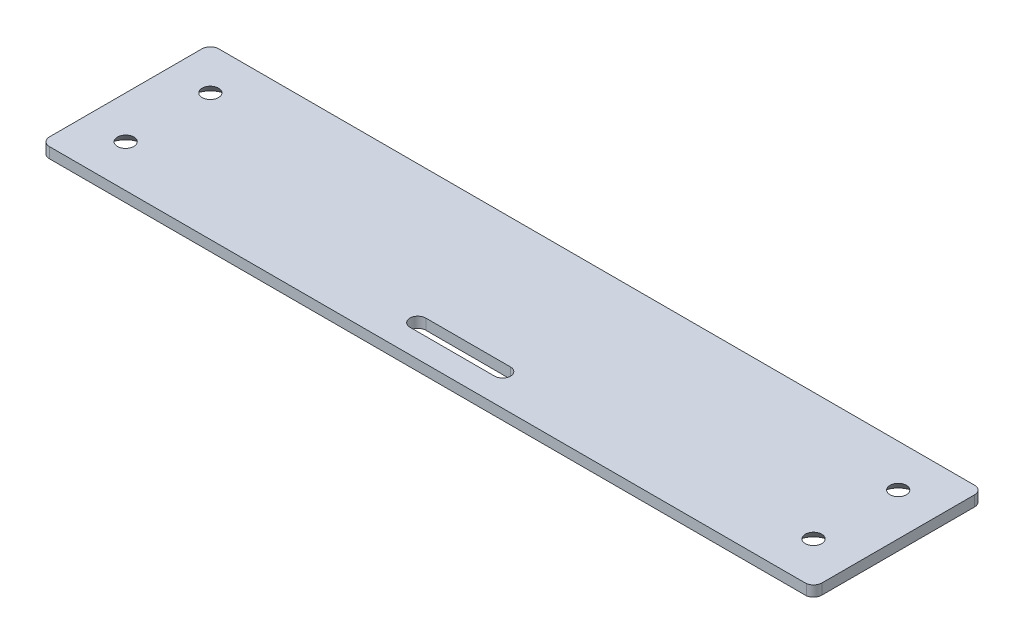
from build123d import *

# Parameters (mm, degrees)
BOSS_EXTRUDE1_DEPTH                   = 3.175
F_10_0_1935_DIAMETER_HOLE1_AT_2_COUNT = 2
F_10_0_1935_DIAMETER_HOLE1_AT_2_PITCH = 25.4
F_10_0_1935_DIAMETER_HOLE1_AT_3_COUNT = 2
F_10_0_1935_DIAMETER_HOLE1_AT_3_PITCH = 207.932201991
F_10_0_1935_DIAMETER_HOLE1_AT_4_COUNT = 2
F_10_0_1935_DIAMETER_HOLE1_AT_4_PITCH = 206.375
CUT_EXTRUDE1_DEPTH                    = 3.175


with BuildPart() as part:
    # Sketch1 → Boss-Extrude1 (new body)
    with BuildSketch(Plane(origin=(0, 0, 0), x_dir=(1, 0, 0), z_dir=(0, 1, 0))):
        with BuildLine():
            Line((22.125366444, -125.50484625), (-204.925528738, -125.50484625))
            ThreePointArc((-204.925528738, -125.50484625), (-206.721579962, -126.248795026), (-207.465528738, -128.04484625))
            Line((-207.465528738, -128.04484625), (-207.465528738, -173.76484625))
            ThreePointArc((-207.465528738, -173.76484625), (-206.721579962, -175.560897474), (-204.925528738, -176.30484625))
            Line((-204.925528738, -176.30484625), (22.125366444, -176.30484625))
            ThreePointArc((22.125366444, -176.30484625), (23.687226951, -175.455380029), (24.309471262, -173.789903185))
            Line((24.309471262, -173.789903185), (24.309471262, -128.019789315))
            ThreePointArc((24.309471262, -128.019789315), (23.687226951, -126.354312471), (22.125366444, -125.50484625))
        make_face()
    extrude(amount=BOSS_EXTRUDE1_DEPTH)

    # Sketch4 → #10 (0.1935) Diameter Hole1 (revolve, cut)
    with BuildSketch(Plane(origin=(11.609471262, 0, 163.60484625), x_dir=(0, 0, -1), z_dir=(1, 0, 0))):
        Polygon((0, 0), (0, 3.175), (2.45745, 3.175), (2.45745, 3.177605133), (5.2197, 0), align=None)
    f_10_0_1935_diameter_hole1 = revolve(axis=Axis((11.609471262, -6.35, 163.60484625), (0, 1, 0)), mode=Mode.SUBTRACT)

    # #10 (0.1935) Diameter Hole1 at 2: #10 (0.1935) Diameter Hole1 ×2
    with Locations(*[(0, 0, -i * F_10_0_1935_DIAMETER_HOLE1_AT_2_PITCH) for i in range(1, F_10_0_1935_DIAMETER_HOLE1_AT_2_COUNT)]):
        add(f_10_0_1935_diameter_hole1, mode=Mode.SUBTRACT)

    # #10 (0.1935) Diameter Hole1 at 3: #10 (0.1935) Diameter Hole1 ×2
    with Locations(*[Vector(-0.9925110109136314, 0, -0.12215520134321609) * (i * F_10_0_1935_DIAMETER_HOLE1_AT_3_PITCH) for i in range(1, F_10_0_1935_DIAMETER_HOLE1_AT_3_COUNT)]):
        add(f_10_0_1935_diameter_hole1, mode=Mode.SUBTRACT)

    # #10 (0.1935) Diameter Hole1 at 4: #10 (0.1935) Diameter Hole1 ×2
    with Locations(*[(-i * F_10_0_1935_DIAMETER_HOLE1_AT_4_PITCH, 0, 0) for i in range(1, F_10_0_1935_DIAMETER_HOLE1_AT_4_COUNT)]):
        add(f_10_0_1935_diameter_hole1, mode=Mode.SUBTRACT)

    # Sketch6 → Cut-Extrude1 (cut)
    with BuildSketch(Plane.XZ):
        with BuildLine():
            Line((-78.522128749, 169.16744625), (-103.922128749, 169.16744625))
            ThreePointArc((-103.922128749, 169.16744625), (-106.309728749, 166.77984625), (-103.922128749, 164.39224625))
            Line((-103.922128749, 164.39224625), (-78.522128749, 164.39224625))
            ThreePointArc((-78.522128749, 164.39224625), (-76.134528749, 166.77984625), (-78.522128749, 169.16744625))
        make_face()
    extrude(amount=-CUT_EXTRUDE1_DEPTH, mode=Mode.SUBTRACT)


solid = part.part
